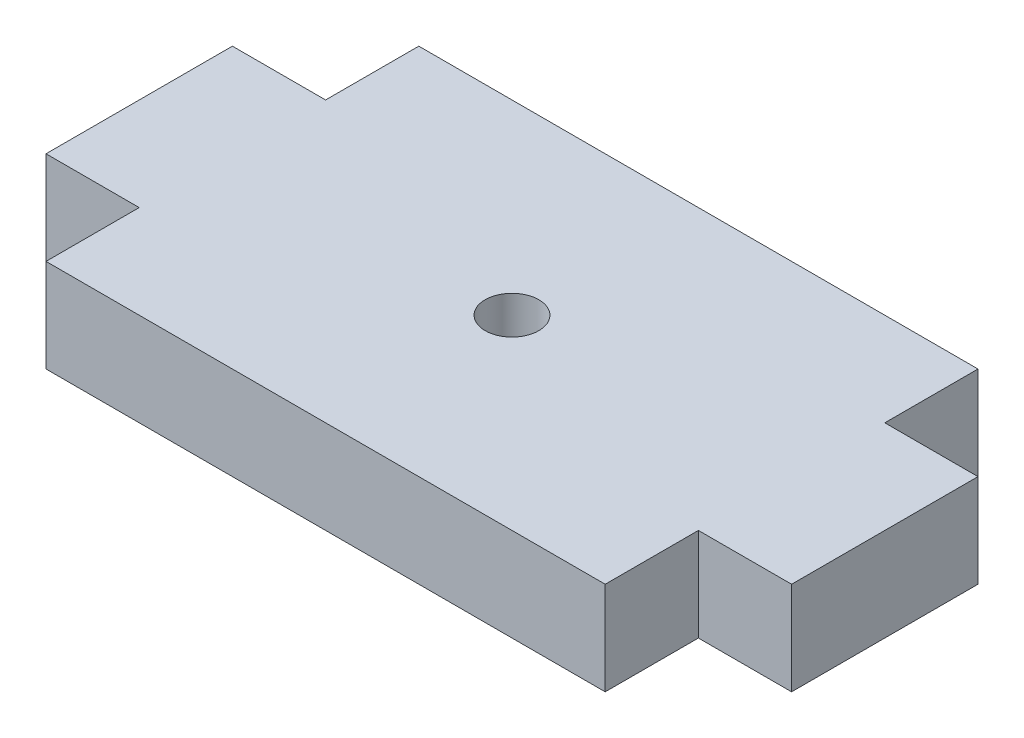
from build123d import *

# Parameters (mm, degrees)
SKETCH1_W           = 38.1
SKETCH1_H           = 25.4
SKETCH1_R           = 1.8288
SKETCH1_W_2         = 6.35
SKETCH1_H_2         = 12.7
BOSS_EXTRUDE1_DEPTH = 6.35


with BuildPart() as part:
    # Sketch1 → Boss-Extrude1 (new body)
    # profile 1 of 3: a face of its own
    with BuildSketch(Plane(origin=(0, 0, 0), x_dir=(1, 0, 0), z_dir=(0, 1, 0))):
        with Locations((19.05, -12.7)):
            Rectangle(SKETCH1_W, SKETCH1_H)
        with Locations(Location((19.05, -12.7, 0), (0, 0, 270))):
            Circle(SKETCH1_R, mode=Mode.SUBTRACT)
    # profile 2 of 3: a face of its own
    with BuildSketch(Plane(origin=(0, 0, 0), x_dir=(1, 0, 0), z_dir=(0, 1, 0))):
        with Locations((41.275, -12.7)):
            Rectangle(SKETCH1_W_2, SKETCH1_H_2)
    # profile 3 of 3: a face of its own
    with BuildSketch(Plane(origin=(0, 0, 0), x_dir=(1, 0, 0), z_dir=(0, 1, 0))):
        with Locations((-3.175, -12.7)):
            Rectangle(SKETCH1_W_2, SKETCH1_H_2)
    extrude(amount=BOSS_EXTRUDE1_DEPTH)


solid = part.part
